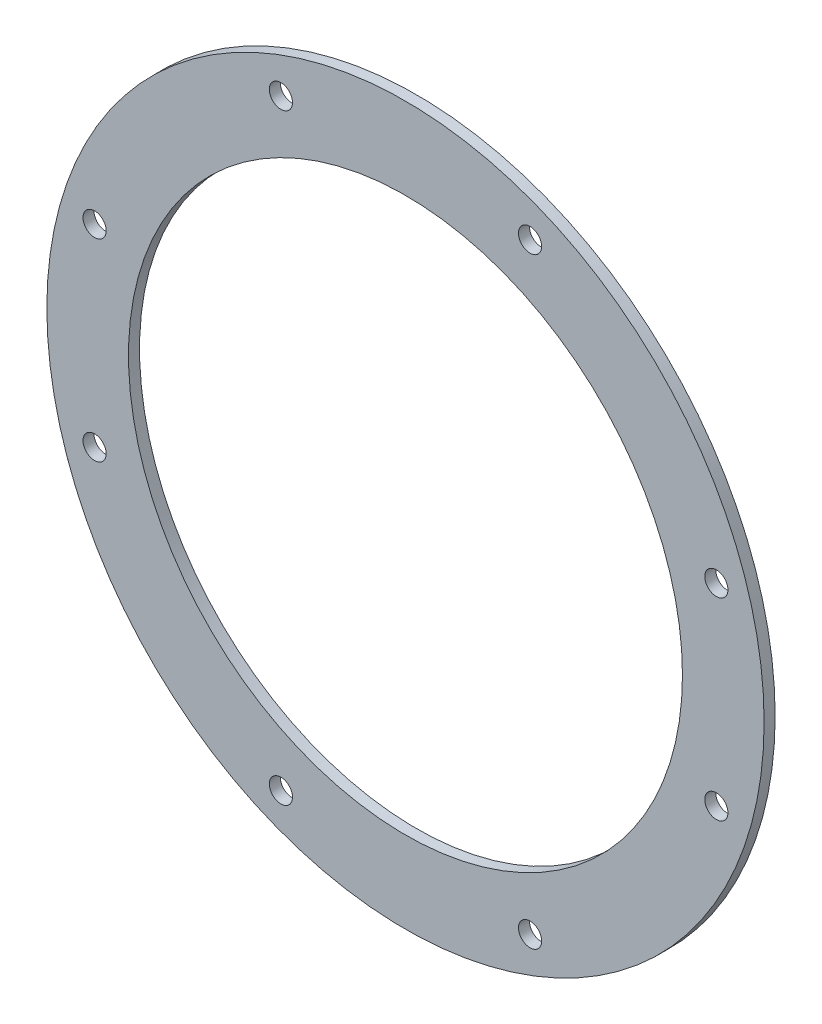
from build123d import *

# Parameters (mm, degrees)
SKETCH_1_R      = 65
SKETCH_1_R_2    = 50.2
SKETCH_1_R_3    = 2.1
EXTRUDE_1_DEPTH = 2


with BuildPart() as part:
    # 草图1 → 凸台-拉伸1 (new body)
    with BuildSketch(Plane.XY):
        Circle(SKETCH_1_R)
        Circle(SKETCH_1_R_2, mode=Mode.SUBTRACT)
        with Locations((22.57832251, 54.508892418)):
            Circle(SKETCH_1_R_3, mode=Mode.SUBTRACT)
        with Locations((22.57832251, -54.508892418)):
            Circle(SKETCH_1_R_3, mode=Mode.SUBTRACT)
        with Locations((-22.57832251, -54.508892418)):
            Circle(SKETCH_1_R_3, mode=Mode.SUBTRACT)
        with Locations((-22.57832251, 54.508892418)):
            Circle(SKETCH_1_R_3, mode=Mode.SUBTRACT)
        with Locations((56.344919913, 17.5)):
            Circle(SKETCH_1_R_3, mode=Mode.SUBTRACT)
        with Locations((56.344919913, -17.5)):
            Circle(SKETCH_1_R_3, mode=Mode.SUBTRACT)
        with Locations((-56.344919913, 17.5)):
            Circle(SKETCH_1_R_3, mode=Mode.SUBTRACT)
        with Locations((-56.344919913, -17.5)):
            Circle(SKETCH_1_R_3, mode=Mode.SUBTRACT)
    extrude(amount=EXTRUDE_1_DEPTH)


solid = part.part
